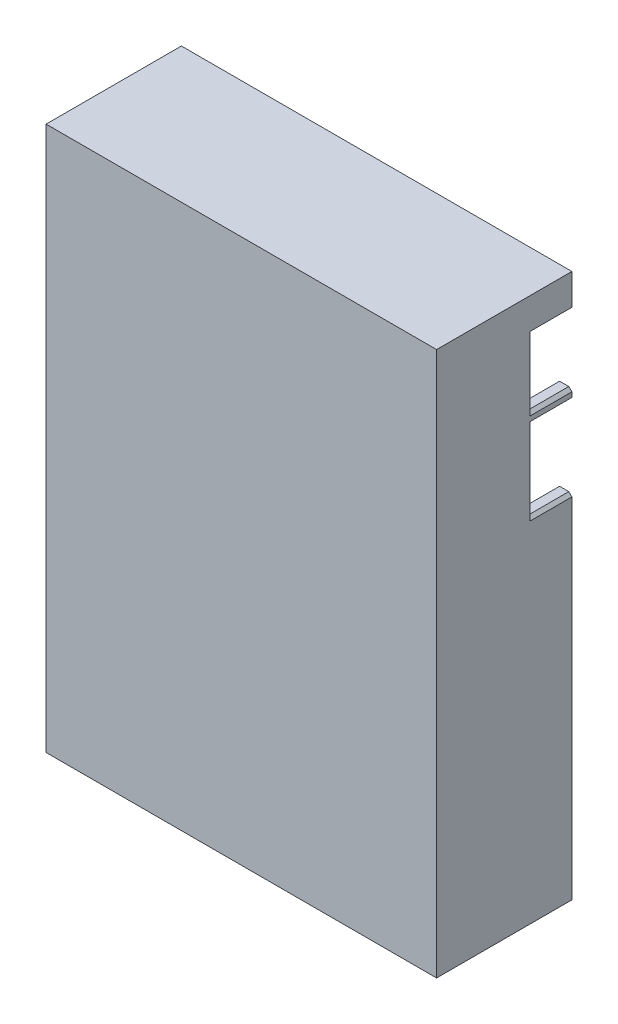
from build123d import *

# Parameters (mm, degrees)
SKETCH2_W           = 63.5
SKETCH2_H           = 88.5
BOSS_EXTRUDE1_DEPTH = 2
SKETCH3_W           = 63.5
SKETCH3_H           = 88.5
SKETCH3_W_2         = 59.5
SKETCH3_H_2         = 84.5
BOSS_EXTRUDE2_DEPTH = 20
SKETCH4_W           = 6.35
SKETCH4_H           = 13
SKETCH4_H_2         = 10.9
CUT_EXTRUDE1_DEPTH  = 2
CHAMFER1_SIZE       = 0.5
SKETCH5_R           = 0.75
SKETCH5_W           = 6.35
SKETCH5_H           = 25
CUT_EXTRUDE3_DEPTH  = 2
FILLET1_R           = 6


with BuildPart() as part:
    # Sketch2 → Boss-Extrude1 (new body)
    with BuildSketch(Plane.XY.offset(2)):
        with Locations((-8.071244, 16.046786)):
            Rectangle(SKETCH2_W, SKETCH2_H)
    extrude(amount=BOSS_EXTRUDE1_DEPTH)

    # Sketch3 → Boss-Extrude2 (add)
    with BuildSketch(Plane(origin=(0, 0, 2), x_dir=(-1, 0, 0), z_dir=(0, 0, -1))):
        with Locations((8.071244, 16.046786)):
            Rectangle(SKETCH3_W, SKETCH3_H)
        with Locations((8.071244, 16.046786)):
            Rectangle(SKETCH3_W_2, SKETCH3_H_2, mode=Mode.SUBTRACT)
    extrude(amount=BOSS_EXTRUDE2_DEPTH)

    # Sketch4 → Cut-Extrude1 (cut)
    with BuildSketch(Plane(origin=(23.678756, 0, 0), x_dir=(0, 0, -1), z_dir=(1, 0, 0))):
        with Locations((14.825, 35.546786)):
            Rectangle(SKETCH4_W, SKETCH4_H)
        with Locations((14.825, 49.296786)):
            Rectangle(SKETCH4_W, SKETCH4_H_2)
    extrude(amount=-CUT_EXTRUDE1_DEPTH, mode=Mode.SUBTRACT)

    # Chamfer1
    chamfer1_edges = [part.edges().sort_by_distance(p)[0] for p in [
        (23.678756, 42.046786, -14.825),
        (23.678756, 35.546786, -11.65),
        (23.678756, 29.046786, -14.825),
        (23.678756, 54.746786, -14.825),
        (23.678756, 49.296786, -11.65),
        (23.678756, 43.846786, -14.825),
    ]]
    chamfer(chamfer1_edges, length=CHAMFER1_SIZE)

    # Sketch5 → Cut-Extrude3 (cut)
    with BuildSketch(Plane.ZY.offset(39.821244)):
        with Locations(Location((-12.431991388, 40.654286, 0), (0, 0, 270))):
            Circle(SKETCH5_R)
        with Locations((-14.825, 21.706977335)):
            Rectangle(SKETCH5_W, SKETCH5_H)
    extrude(amount=-CUT_EXTRUDE3_DEPTH, mode=Mode.SUBTRACT)

    # Fillet1
    fillet1_edges = [part.edges().sort_by_distance(p)[0] for p in [
        (-38.821244, 34.206977335, -18),
        (-38.821244, 9.206977335, -18),
    ]]
    fillet(fillet1_edges, radius=FILLET1_R)


solid = part.part
